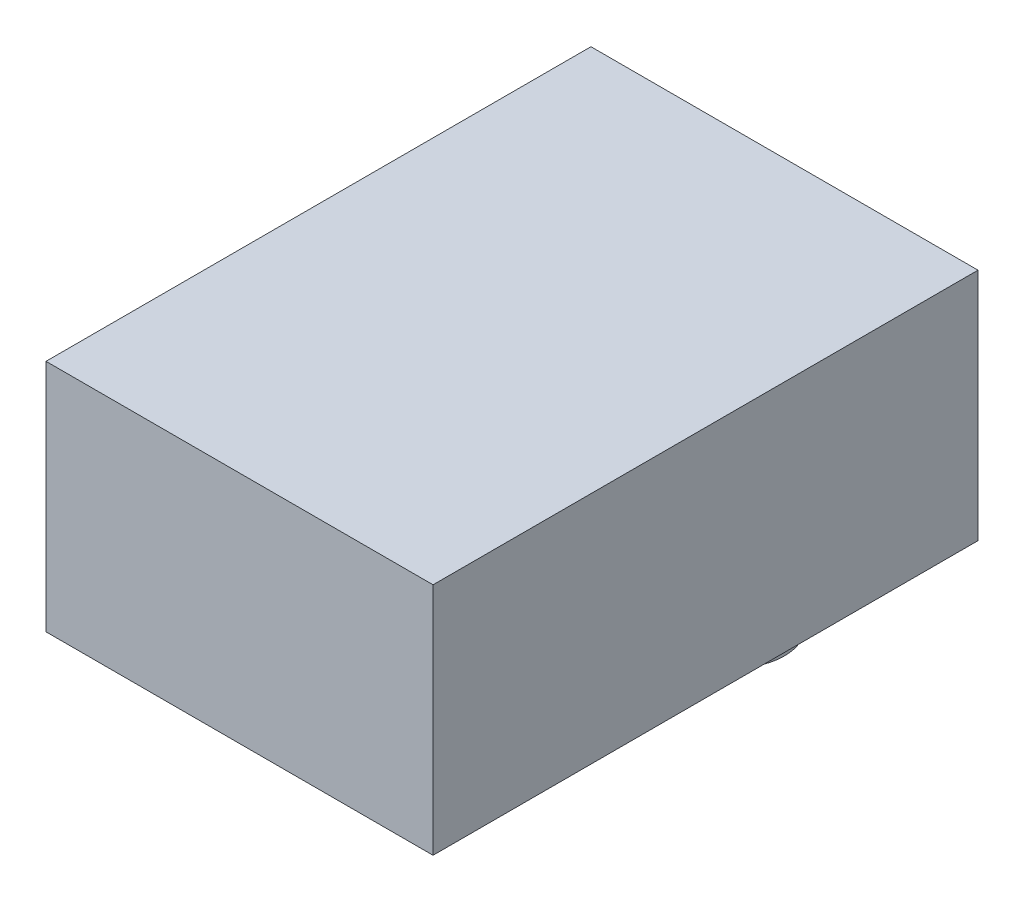
from build123d import *

# Parameters (mm, degrees)
SKETCH1_R           = 2.35
BOSS_EXTRUDE1_DEPTH = 9.3
SKETCH2_R           = 2.8
CUT_EXTRUDE1_DEPTH  = 6.5
SKETCH3_W           = 38
SKETCH3_H           = 53.5
BOSS_EXTRUDE2_DEPTH = 23


with BuildPart() as part:
    # Sketch1 → Boss-Extrude1 (new body)
    with BuildSketch(Plane(origin=(0, 0, 0), x_dir=(1, 0, 0), z_dir=(0, 1, 0))):
        with BuildLine():
            Line((-0.5, 7), (-0.5, 4.974937186))
            ThreePointArc((-0.5, 4.974937186), (-1.913417162, 4.619397663), (-3.164258429, 3.87136521))
            Line((-3.164258429, 3.87136521), (-4.583551024, 5.290657805))
            Line((-4.583551024, 5.290657805), (-5.290657805, 4.583551024))
            Line((-5.290657805, 4.583551024), (-3.87136521, 3.164258429))
            ThreePointArc((-3.87136521, 3.164258429), (1.913417162, -4.619397663), (0.5, 4.974937186))
            Line((0.5, 4.974937186), (0.5, 7))
            Line((0.5, 7), (-0.5, 7))
        make_face()
        with Locations(Location((0, 0, 0), (0, 0, 270))):
            Circle(SKETCH1_R, mode=Mode.SUBTRACT)
    extrude(amount=BOSS_EXTRUDE1_DEPTH)

    # Sketch2 → Cut-Extrude1 (cut)
    with BuildSketch(Plane(origin=(0, 9.3, 0), x_dir=(1, 0, 0), z_dir=(0, 1, 0))):
        with Locations(Location((0, 0, 0), (0, 0, 270))):
            Circle(SKETCH2_R)
    extrude(amount=-CUT_EXTRUDE1_DEPTH, mode=Mode.SUBTRACT)

    # Sketch3 → Boss-Extrude2 (add)
    with BuildSketch(Plane(origin=(0, 9.3, 0), x_dir=(1, 0, 0), z_dir=(0, 1, 0))):
        with Locations((-5, -16.75)):
            Rectangle(SKETCH3_W, SKETCH3_H)
    extrude(amount=BOSS_EXTRUDE2_DEPTH)


solid = part.part
